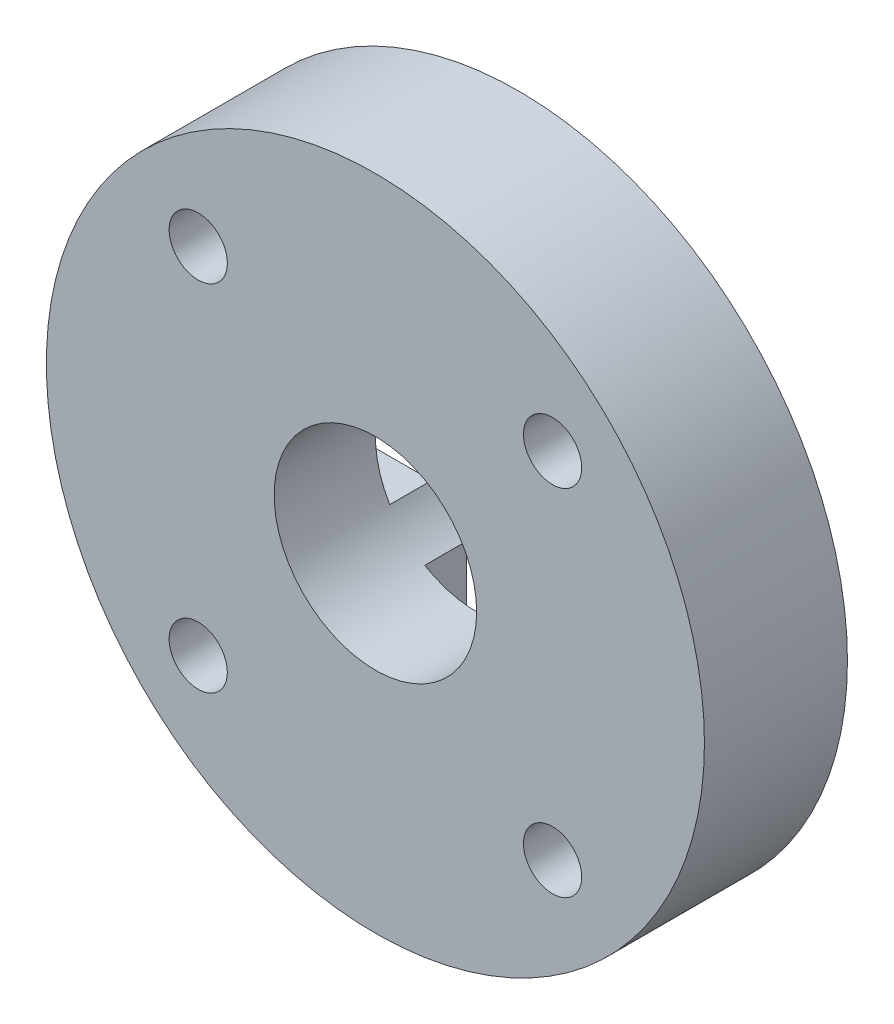
from build123d import *

# Parameters (mm, degrees)
TRIAL_LOAD_PLATE_PROFILE_R           = 13
TRIAL_LOAD_PLATE_PROFILE_R_2         = 4
TRIAL_LOAD_PLATE_DEPTH               = 4
CAPTURED_HORN_KEY_BOSS_START         = -1.65
CAPTURED_HORN_KEY_BOSS_PROFILE_R     = 13
CAPTURED_HORN_KEY_BOSS_DEPTH         = 1.65
KEY_POCKET_HUB_START                 = -1.65
STOCK_HORN_POCKET_HUB_R              = 3.5
KEY_POCKET_HUB_DEPTH                 = 1.65
KEY_POCKET_HORIZONTAL_START          = -1.65
STOCK_HORN_POCKET_HORIZONTAL_W       = 16.3
STOCK_HORN_POCKET_HORIZONTAL_H       = 4.1
KEY_POCKET_HORIZONTAL_DEPTH          = 1.65
KEY_POCKET_VERTICAL_START            = -1.65
STOCK_HORN_POCKET_VERTICAL_W         = 4.1
STOCK_HORN_POCKET_VERTICAL_H         = 16.3
KEY_POCKET_VERTICAL_DEPTH            = 1.65
KEY_POCKET_ROUNDED_TIPS_START        = -1.65
STOCK_HORN_POCKET_ROUNDED_TIPS_R     = 2.05
KEY_POCKET_ROUNDED_TIPS_DEPTH        = 1.65
UNMODIFIED_HORN_CAPTURE_M2_START     = -50
UNMODIFIED_HORN_CAPTURE_M2_PROFILE_R = 1.15
UNMODIFIED_HORN_CAPTURE_M2_DEPTH     = 69.814887722
HUB_CLEARANCE_IN_KEY_BOSS_ONLY_START = -1.65
HORN_CENTER_HUB_CLEARANCE_R          = 4
HUB_CLEARANCE_IN_KEY_BOSS_ONLY_DEPTH = 1.65


with BuildPart() as part:
    # Trial_load_plate_profile → Trial_load_plate (new body)
    with BuildSketch(Plane.XY):
        Circle(TRIAL_LOAD_PLATE_PROFILE_R)
        Circle(TRIAL_LOAD_PLATE_PROFILE_R_2, mode=Mode.SUBTRACT)
    extrude(amount=TRIAL_LOAD_PLATE_DEPTH)

    # Captured_horn_key_boss_profile → Captured_horn_key_boss (add)
    with BuildSketch(Plane.XY.offset(CAPTURED_HORN_KEY_BOSS_START)):
        Circle(CAPTURED_HORN_KEY_BOSS_PROFILE_R)
    extrude(amount=CAPTURED_HORN_KEY_BOSS_DEPTH)

    # Stock_horn_pocket_Hub → Key_pocket_Hub (cut)
    with BuildSketch(Plane.XY.offset(KEY_POCKET_HUB_START)):
        Circle(STOCK_HORN_POCKET_HUB_R)
    extrude(amount=KEY_POCKET_HUB_DEPTH, mode=Mode.SUBTRACT)

    # Stock_horn_pocket_Horizontal → Key_pocket_Horizontal (cut)
    with BuildSketch(Plane.XY.offset(KEY_POCKET_HORIZONTAL_START)):
        Rectangle(STOCK_HORN_POCKET_HORIZONTAL_W, STOCK_HORN_POCKET_HORIZONTAL_H)
    extrude(amount=KEY_POCKET_HORIZONTAL_DEPTH, mode=Mode.SUBTRACT)

    # Stock_horn_pocket_Vertical → Key_pocket_Vertical (cut)
    with BuildSketch(Plane.XY.offset(KEY_POCKET_VERTICAL_START)):
        Rectangle(STOCK_HORN_POCKET_VERTICAL_W, STOCK_HORN_POCKET_VERTICAL_H)
    extrude(amount=KEY_POCKET_VERTICAL_DEPTH, mode=Mode.SUBTRACT)

    # Stock_horn_pocket_Rounded_tips → Key_pocket_Rounded_tips (cut)
    with BuildSketch(Plane.XY.offset(KEY_POCKET_ROUNDED_TIPS_START)):
        with Locations((8.15, 0)):
            Circle(STOCK_HORN_POCKET_ROUNDED_TIPS_R)
        with Locations((-8.15, 0)):
            Circle(STOCK_HORN_POCKET_ROUNDED_TIPS_R)
        with Locations((0, 8.15)):
            Circle(STOCK_HORN_POCKET_ROUNDED_TIPS_R)
        with Locations((0, -8.15)):
            Circle(STOCK_HORN_POCKET_ROUNDED_TIPS_R)
    extrude(amount=KEY_POCKET_ROUNDED_TIPS_DEPTH, mode=Mode.SUBTRACT)

    # Unmodified_horn_capture_M2_profile → Unmodified_horn_capture_M2 (cut, through all)
    with BuildSketch(Plane.XY.offset(UNMODIFIED_HORN_CAPTURE_M2_START)):
        with Locations((7, 7)):
            Circle(UNMODIFIED_HORN_CAPTURE_M2_PROFILE_R)
        with Locations((-7, 7)):
            Circle(UNMODIFIED_HORN_CAPTURE_M2_PROFILE_R)
        with Locations((-7, -7)):
            Circle(UNMODIFIED_HORN_CAPTURE_M2_PROFILE_R)
        with Locations((7, -7)):
            Circle(UNMODIFIED_HORN_CAPTURE_M2_PROFILE_R)
    extrude(amount=UNMODIFIED_HORN_CAPTURE_M2_DEPTH, mode=Mode.SUBTRACT)

    # Horn_center_hub_clearance → Hub_clearance_in_key_boss_only (cut)
    with BuildSketch(Plane.XY.offset(HUB_CLEARANCE_IN_KEY_BOSS_ONLY_START)):
        with Locations(Location((0, 0, 0), (0, 0, 149.169502568))):
            Circle(HORN_CENTER_HUB_CLEARANCE_R)
    extrude(amount=HUB_CLEARANCE_IN_KEY_BOSS_ONLY_DEPTH, mode=Mode.SUBTRACT)


solid = part.part
